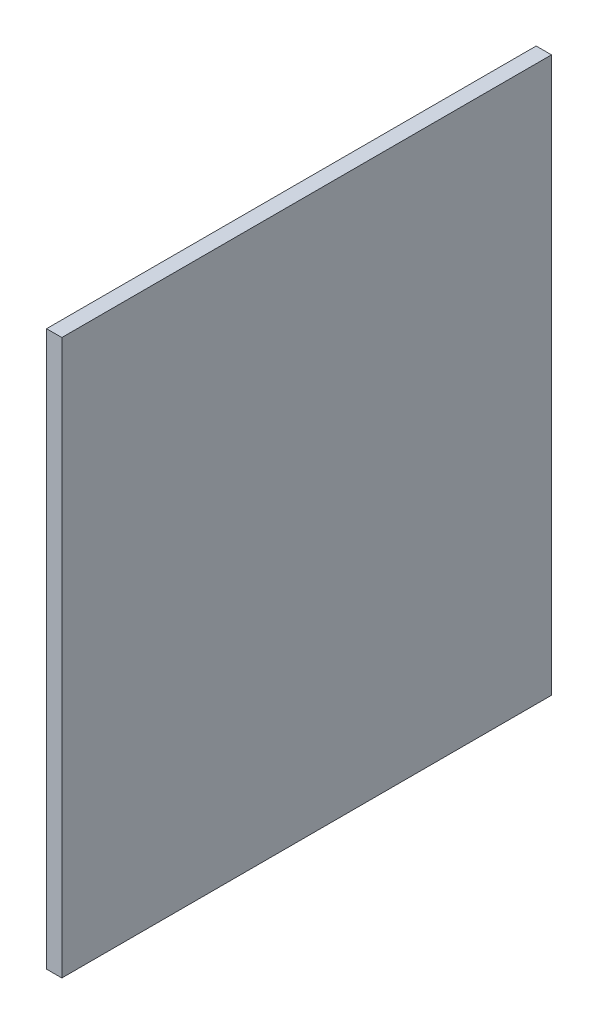
from build123d import *

# Parameters (mm, degrees)
SKETCH1_W           = 1280
SKETCH1_H           = 1450
BOSS_EXTRUDE1_DEPTH = 40


with BuildPart() as part:
    # Sketch1 → Boss-Extrude1 (new body)
    with BuildSketch(Plane(origin=(0, 0, 0), x_dir=(0, 0, -1), z_dir=(1, 0, 0))):
        with Locations((-116.52173913, -216.149068323)):
            Rectangle(SKETCH1_W, SKETCH1_H)
    extrude(amount=BOSS_EXTRUDE1_DEPTH)


solid = part.part
